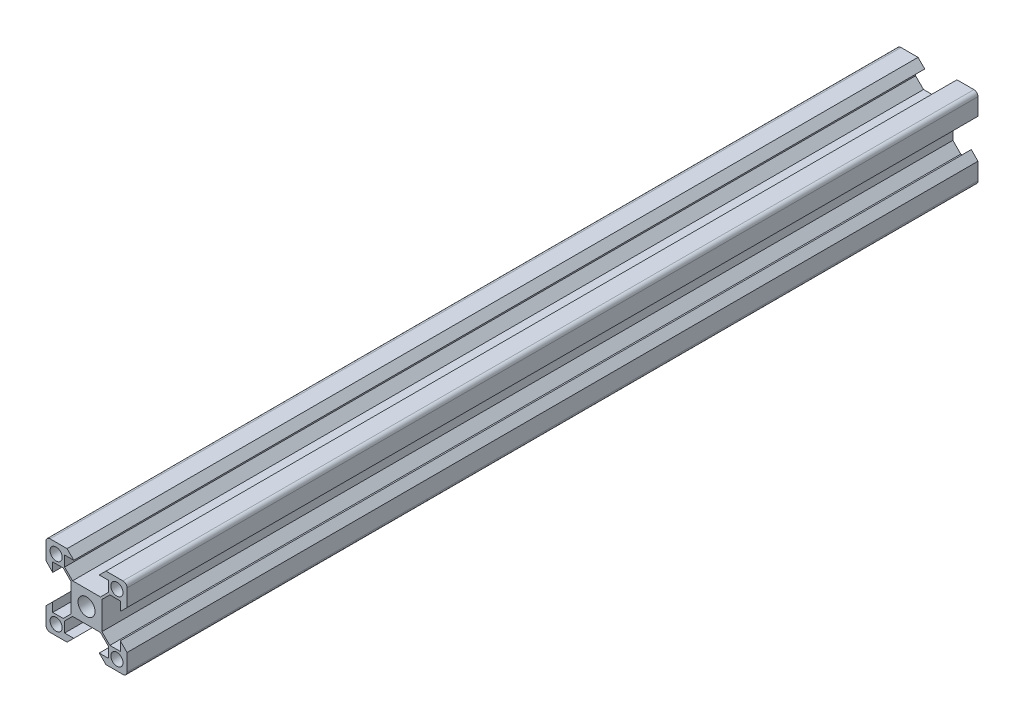
from build123d import *

# Parameters (mm, degrees)
SKETCH_1_R      = 1.5
SKETCH_1_R_2    = 2.1
EXTRUDE_1_DEPTH = 105
FILLET_1_R      = 1


with BuildPart() as part:
    # 草图1 → 凸台-拉伸1 (new, symmetric)
    with BuildSketch(Plane.XY):
        Polygon((-10, 10), (-10, 4.8), (-8.34, 3.14), (-8.34, 5.4), (-5.753553391, 5.4), (-3.8, 3.446446609), (-3.8, -3.446446609), (-5.753553391, -5.4), (-8.34, -5.4), (-8.34, -3.14), (-10, -4.8), (-10, -10), (-4.8, -10), (-3.14, -8.34), (-5.4, -8.34), (-5.4, -5.753553391), (-3.446446609, -3.8), (3.446446609, -3.8), (5.4, -5.753553391), (5.4, -8.34), (3.14, -8.34), (4.8, -10), (10, -10), (10, -4.8), (8.34, -3.14), (8.34, -5.4), (5.753553391, -5.4), (3.8, -3.446446609), (3.8, 3.446446609), (5.753553391, 5.4), (8.34, 5.4), (8.34, 3.14), (10, 4.8), (10, 10), (4.8, 10), (3.14, 8.34), (5.4, 8.34), (5.4, 5.753553391), (3.446446609, 3.8), (-3.446446609, 3.8), (-5.4, 5.753553391), (-5.4, 8.34), (-3.14, 8.34), (-4.8, 10), align=None)
        with Locations((-7.5, 7.5)):
            Circle(SKETCH_1_R, mode=Mode.SUBTRACT)
        Circle(SKETCH_1_R_2, mode=Mode.SUBTRACT)
        with Locations(Location((-7.5, -7.5, 0), (0, 0, 180))):
            Circle(SKETCH_1_R, mode=Mode.SUBTRACT)
        with Locations((7.5, -7.5)):
            Circle(SKETCH_1_R, mode=Mode.SUBTRACT)
        with Locations(Location((7.5, 7.5, 0), (0, 0, 180))):
            Circle(SKETCH_1_R, mode=Mode.SUBTRACT)
    extrude(amount=EXTRUDE_1_DEPTH, both=True)

    # 圆角1
    fillet_1_edges = [part.edges().sort_by_distance(p)[0] for p in [
        (10, 10, 0),
        (10, -10, 0),
        (-10, -10, 0),
        (-10, 10, 0),
    ]]
    fillet(fillet_1_edges, radius=FILLET_1_R)


solid = part.part
